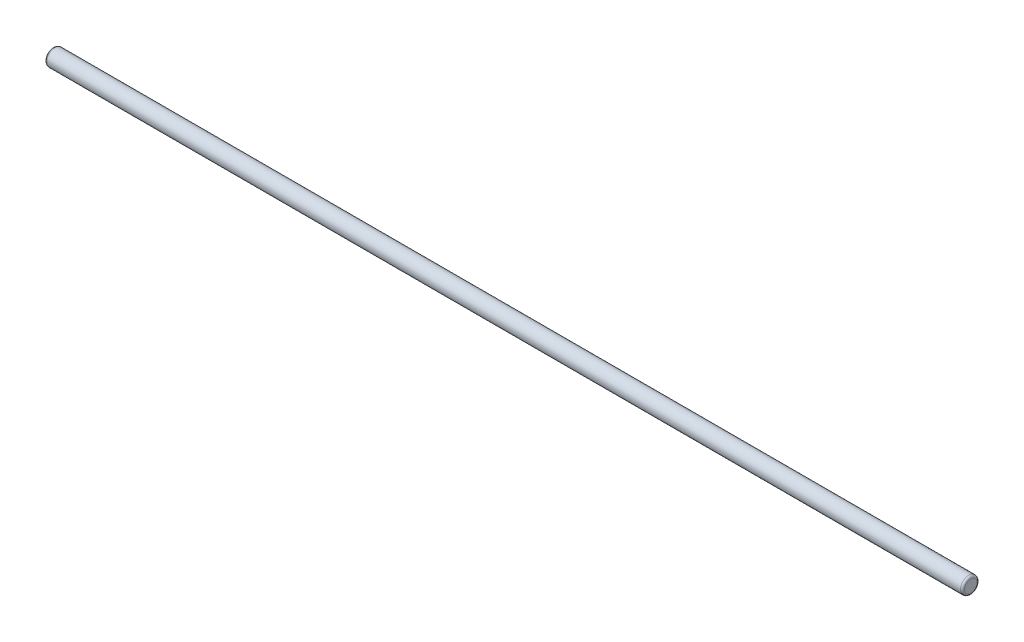
from build123d import *

# Parameters (mm, degrees)
PROFILESKETCH1_R           = 4
PROFILEBOSS_EXTRUDE1_DEPTH = 440
FILLET1_R                  = 1


with BuildPart() as part:
    # ProfileSketch1 → ProfileBoss-Extrude1 (new body)
    with BuildSketch(Plane(origin=(0, 0, 0), x_dir=(0, 0, -1), z_dir=(1, 0, 0))):
        Circle(PROFILESKETCH1_R)
    extrude(amount=PROFILEBOSS_EXTRUDE1_DEPTH)

    # Fillet1
    fillet1_edges = [part.edges().sort_by_distance(p)[0] for p in [
        (0, 0, 4),
        (440, 0, 4),
    ]]
    fillet(fillet1_edges, radius=FILLET1_R)


solid = part.part
